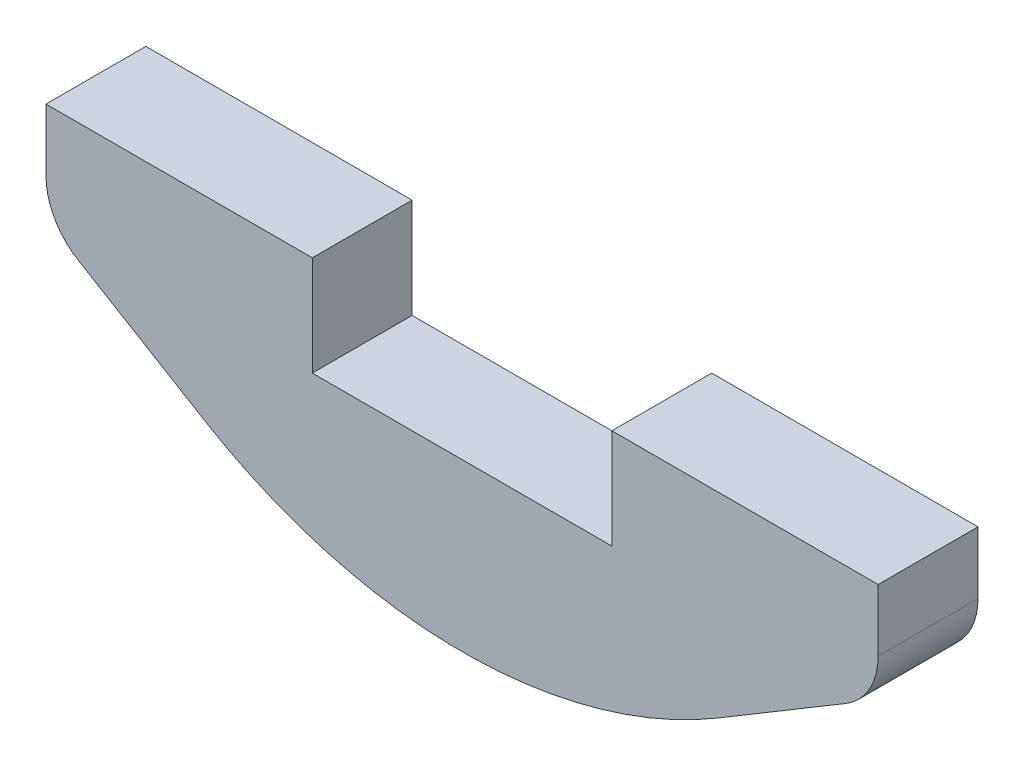
from build123d import *

# Parameters (mm, degrees)
CROQUIS1_W              = 8
CROQUIS1_H              = 3
SALIENTE_EXTRUIR1_DEPTH = 3
REDONDEO1_R             = 2


with BuildPart() as part:
    # Croquis1 → Saliente-Extruir1 (new body)
    with BuildSketch(Plane.XY):
        with BuildLine():
            Line((-12.5, 0), (-7.703315155, -2.870856056))
            ThreePointArc((-7.703315155, -2.870856056), (0, -5), (7.703315155, -2.870856056))
            Line((7.703315155, -2.870856056), (12.5, 0))
            Line((12.5, 0), (-12.5, 0))
        make_face()
        with Locations((-8.5, 1.5)):
            Rectangle(CROQUIS1_W, CROQUIS1_H)
        with Locations((8.5, 1.5)):
            Rectangle(CROQUIS1_W, CROQUIS1_H)
    extrude(amount=SALIENTE_EXTRUIR1_DEPTH)

    # Redondeo1
    redondeo1_edges = [part.edges().sort_by_distance(p)[0] for p in [
        (-12.5, 0, 1.5),
        (12.5, 0, 1.5),
    ]]
    fillet(redondeo1_edges, radius=REDONDEO1_R)


solid = part.part
